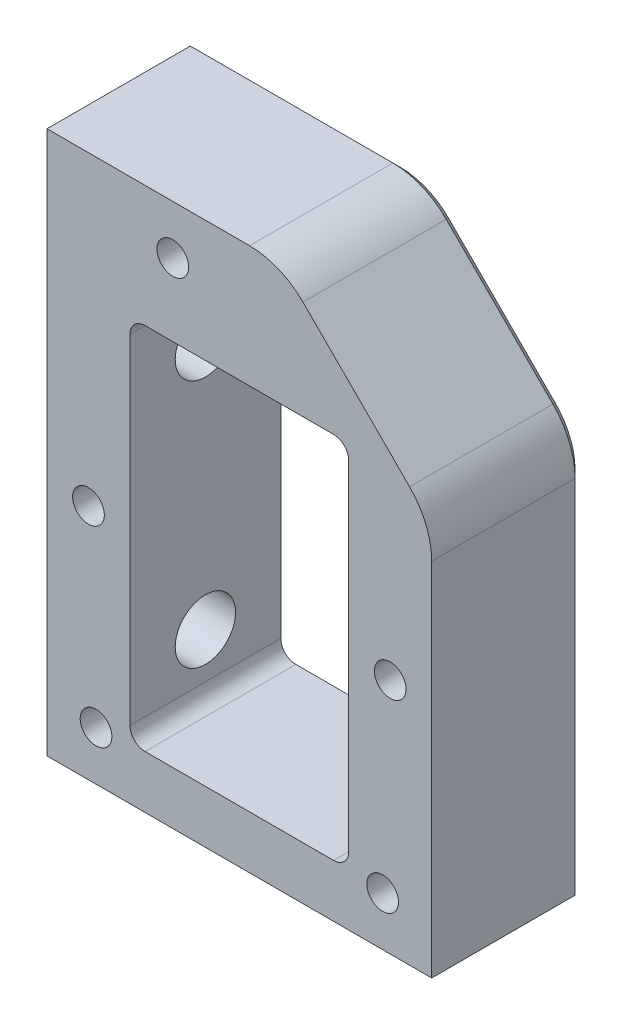
from build123d import *

# Parameters (mm, degrees)
SKETCH1_W           = 29
SKETCH1_H           = 48.9
BOSS_EXTRUDE1_DEPTH = 20
SKETCH2_R           = 2.1
CUT_EXTRUDE1_DEPTH  = 52.909079167
FILLET1_R           = 2
FILLET2_R           = 10
CHAMFER1_SIZE       = 1
CUT_EXTRUDE2_REACH  = 70.156
SKETCH3_R           = 2.1
CUT_EXTRUDE3_REACH  = 66.5
SKETCH4_R           = 4
SKETCH5_R           = 2.1
CUT_EXTRUDE4_DEPTH  = 10


with BuildPart() as part:
    # Sketch1 → Boss-Extrude1 (new body)
    with BuildSketch(Plane.XY):
        Polygon((-25.5, 40.55), (5.5, 40.55), (25.5, 20.55), (25.5, -31.45), (-25.5, -31.45), align=None)
        Rectangle(SKETCH1_W, SKETCH1_H, mode=Mode.SUBTRACT)
    extrude(amount=BOSS_EXTRUDE1_DEPTH)

    # Sketch2 → Cut-Extrude1 (cut, through all)
    with BuildSketch(Plane(origin=(0, 0, 0), x_dir=(-1, 0, 0), z_dir=(0, 0, -1))):
        with Locations((-20, 0)):
            Circle(SKETCH2_R)
        with Locations((20, 0)):
            Circle(SKETCH2_R)
    extrude(amount=-CUT_EXTRUDE1_DEPTH, mode=Mode.SUBTRACT)

    # Fillet1
    fillet1_edges = [part.edges().sort_by_distance(p)[0] for p in [
        (14.5, -24.45, 10),
        (14.5, 24.45, 10),
        (-14.5, 24.45, 10),
        (-14.5, -24.45, 10),
    ]]
    fillet(fillet1_edges, radius=FILLET1_R)

    # Fillet2
    fillet2_edges = [part.edges().sort_by_distance(p)[0] for p in [
        (5.5, 40.55, 10),
        (25.5, 20.55, 10),
    ]]
    fillet(fillet2_edges, radius=FILLET2_R)

    # Chamfer1
    chamfer1_edges = [part.edges().sort_by_distance(p)[0] for p in [
        (25.5, -7.521067812, 0),
        (15.5, 30.55, 0),
        (-12.071067812, 40.55, 0),
        (5.1846987, 39.788795325, 0),
        (24.738795325, 20.2346987, 0),
    ]]
    chamfer(chamfer1_edges, length=CHAMFER1_SIZE)

    # Sketch3 → Cut-Extrude2 (cut, up to next)
    with BuildSketch(Plane.ZY.offset(25.5), mode=Mode.PRIVATE) as cut_extrude2_sk1:
        with Locations((10, 16.55)):
            Circle(SKETCH3_R)
    cut_extrude2_tool1 = extrude(cut_extrude2_sk1.sketch, amount=-CUT_EXTRUDE2_REACH, mode=Mode.PRIVATE) & part.part
    # Sketch3 → Cut-Extrude2 (cut, up to next)
    with BuildSketch(Plane.ZY.offset(25.5), mode=Mode.PRIVATE) as cut_extrude2_sk2:
        with Locations((10, -16.45)):
            Circle(SKETCH3_R)
    cut_extrude2_tool2 = extrude(cut_extrude2_sk2.sketch, amount=-CUT_EXTRUDE2_REACH, mode=Mode.PRIVATE) & part.part
    add(cut_extrude2_tool1.solids().sort_by_distance((-25.5, 16.55, 10))[0], mode=Mode.SUBTRACT)
    add(cut_extrude2_tool2.solids().sort_by_distance((-25.5, -16.45, 10))[0], mode=Mode.SUBTRACT)

    # Sketch4 → Cut-Extrude3 (cut, up to next)
    with BuildSketch(Plane.ZY.offset(20.5), mode=Mode.PRIVATE) as cut_extrude3_sk1:
        with Locations((10, 16.55)):
            Circle(SKETCH4_R)
    cut_extrude3_tool1 = extrude(cut_extrude3_sk1.sketch, amount=-CUT_EXTRUDE3_REACH, mode=Mode.PRIVATE) & part.part
    # Sketch4 → Cut-Extrude3 (cut, up to next)
    with BuildSketch(Plane.ZY.offset(20.5), mode=Mode.PRIVATE) as cut_extrude3_sk2:
        with Locations((10, -16.45)):
            Circle(SKETCH4_R)
    cut_extrude3_tool2 = extrude(cut_extrude3_sk2.sketch, amount=-CUT_EXTRUDE3_REACH, mode=Mode.PRIVATE) & part.part
    add(cut_extrude3_tool1.solids().sort_by_distance((-20.5, 16.55, 10))[0], mode=Mode.SUBTRACT)
    add(cut_extrude3_tool2.solids().sort_by_distance((-20.5, -16.45, 10))[0], mode=Mode.SUBTRACT)

    # Sketch5 → Cut-Extrude4 (cut)
    with BuildSketch(Plane.XY.offset(20)):
        with Locations((19, -24.95)):
            Circle(SKETCH5_R)
        with Locations((-8.821067812, 34.05)):
            Circle(SKETCH5_R)
        with Locations((-19, -24.95)):
            Circle(SKETCH5_R)
    extrude(amount=-CUT_EXTRUDE4_DEPTH, mode=Mode.SUBTRACT)


solid = part.part
